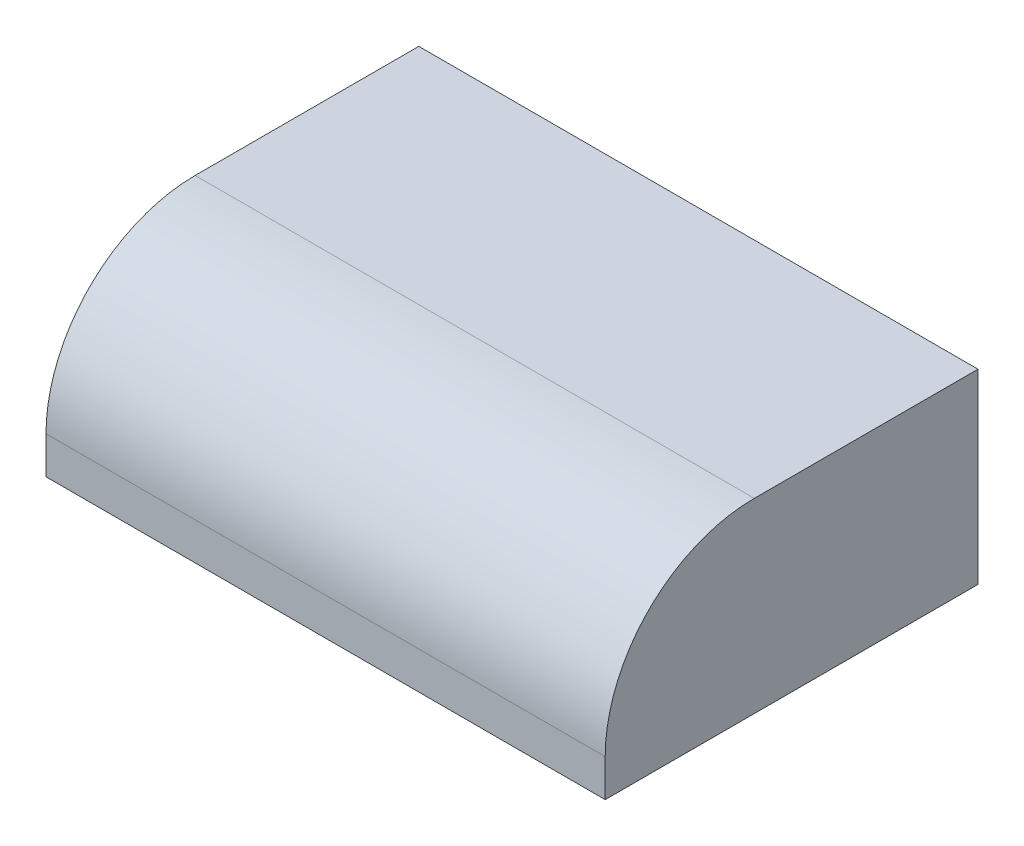
from build123d import *

# Parameters (mm, degrees)
SKETCH3_W           = 9.525
SKETCH3_H           = 6.35
BOSS_EXTRUDE3_DEPTH = 3.175
FILLET1_R           = 2.54


with BuildPart() as part:
    # Sketch3 → Boss-Extrude3 (new body)
    with BuildSketch(Plane(origin=(0, 0, 0), x_dir=(1, 0, 0), z_dir=(0, 1, 0))):
        Rectangle(SKETCH3_W, SKETCH3_H)
    extrude(amount=BOSS_EXTRUDE3_DEPTH)

    # Fillet1
    fillet1_edges = [part.edges().sort_by_distance(p)[0] for p in [
        (0, 3.175, 3.175),
    ]]
    fillet(fillet1_edges, radius=FILLET1_R)


solid = part.part
